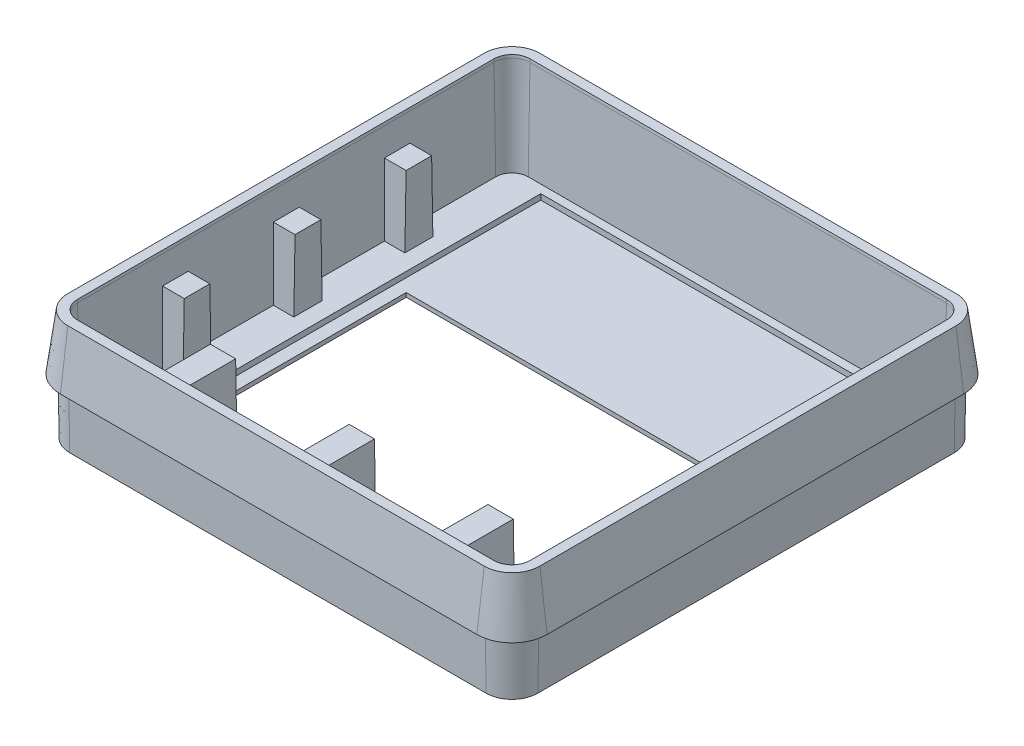
from build123d import *

# Parameters (mm, degrees)
BOSS_EXTRUDE1_DEPTH  = 4
BOSS_EXTRUDE1_DRAFT  = -1
SHELL1_T             = -0.35
SKETCH2_W            = 12.58
SKETCH2_H            = 6.98
CUT_EXTRUDE1_DEPTH   = 2
SKETCH3_W            = 13.5
SKETCH3_H            = 13.096235698
CUT_EXTRUDE2_DEPTH   = 0.2
BOSS_EXTRUDE3_REACH  = 20.425
BOSS_EXTRUDE4_REACH  = 20.425
LPATTERN2_COUNT      = 2
LPATTERN2_PITCH      = 4
MIRROR4_COPY_1_REACH = 20.425
LPATTERN3_COUNT      = 2
LPATTERN3_PITCH      = 4
MIRROR5_COPY_1_REACH = 20.425
BOSS_EXTRUDE5_REACH  = 18.785
LPATTERN4_COUNT      = 2
LPATTERN4_PITCH      = 5
MIRROR6_COPY_1_REACH = 18.785
MIRROR6_COPY_2_REACH = 18.785


with BuildPart() as part:
    # Sketch1 → Boss-Extrude1 (with draft: the straight prism first)
    with BuildSketch(Plane(origin=(0, 0, 0), x_dir=(1, 0, 0), z_dir=(0, 1, 0))):
        with BuildLine():
            Line((-7.5, -8.5), (7.5, -8.5))
            ThreePointArc((7.5, -8.5), (8.207106781, -8.207106781), (8.5, -7.5))
            Line((8.5, -7.5), (8.5, 7.5))
            ThreePointArc((8.5, 7.5), (8.207106781, 8.207106781), (7.5, 8.5))
            Line((7.5, 8.5), (-7.5, 8.5))
            ThreePointArc((-7.5, 8.5), (-8.207106781, 8.207106781), (-8.5, 7.5))
            Line((-8.5, 7.5), (-8.5, -7.5))
            ThreePointArc((-8.5, -7.5), (-8.207106781, -8.207106781), (-7.5, -8.5))
        make_face()
    extrude(amount=-BOSS_EXTRUDE1_DEPTH)
    # Boss-Extrude1: the draft: its side faces are tilted about the plane it starts from
    boss_extrude1_sides = [part.faces().sort_by_distance(p)[0] for p in [
        (0, -2, 8.5),
        (8.207106781, -2, 8.207106781),
        (8.5, -2, 0),
        (8.207106781, -2, -8.207106781),
        (0, -2, -8.5),
        (-8.207106781, -2, -8.207106781),
        (-8.5, -2, 0),
        (-8.207106781, -2, 8.207106781),
    ]]
    draft(boss_extrude1_sides, Plane(origin=(0, 0, 0), x_dir=(1, 0, 0), z_dir=(0, 1, 0)), BOSS_EXTRUDE1_DRAFT)

    # Shell1
    shell1_openings = [part.faces().sort_by_distance(p)[0] for p in [
        (0, 0, 0),
    ]]
    offset(amount=SHELL1_T, openings=shell1_openings, kind=Kind.INTERSECTION)

    # Sketch2 → Cut-Extrude1 (cut)
    with BuildSketch(Plane.XZ.offset(4)):
        with Locations((0, 1.01)):
            Rectangle(SKETCH2_W, SKETCH2_H)
    extrude(amount=-CUT_EXTRUDE1_DEPTH, mode=Mode.SUBTRACT)

    # Sketch3 → Cut-Extrude2 (cut)
    with BuildSketch(Plane(origin=(0, -3.65, 0), x_dir=(1, 0, 0), z_dir=(0, 1, 0))):
        with Locations((0, 1.238117849)):
            Rectangle(SKETCH3_W, SKETCH3_H)
    extrude(amount=-CUT_EXTRUDE2_DEPTH, mode=Mode.SUBTRACT)

    # Boss-Extrude3: up to this plane
    boss_extrude3_end = Plane(origin=(8.150053307, 0.006108342, 7.5), z_dir=(0.9998476951563913, -0.01745240643728355, 0))
    # Sketch11 → Boss-Extrude3 (add, up to the surface)
    with BuildSketch(Plane.ZY.offset(-7.35), mode=Mode.PRIVATE) as boss_extrude3_sk1:
        Polygon((-0.455489584, -1.1), (0.46508987, -1.1), (0.509600286, -3.65), (-0.5, -3.65), align=None)
    boss_extrude3_tool1 = split(extrude(boss_extrude3_sk1.sketch, amount=-BOSS_EXTRUDE3_REACH, mode=Mode.PRIVATE), bisect_by=boss_extrude3_end, keep=Keep.BOTH, mode=Mode.PRIVATE)
    boss_extrude3 = boss_extrude3_tool1.solids().sort_by_distance((7.35, -2.394601, 0.0048))[0]
    add(boss_extrude3)

    # Boss-Extrude4: up to this plane
    boss_extrude4_end = Plane(origin=(-8.150053307, 0.006108342, 7.5), z_dir=(-0.9998476951563913, -0.01745240643728355, 0))
    # Sketch13 → Boss-Extrude4 (add, up to the surface)
    with BuildSketch(Plane(origin=(-7.35, 0, 0), x_dir=(0, 0, -1), z_dir=(1, 0, 0)), mode=Mode.PRIVATE) as boss_extrude4_sk1:
        Polygon((-0.5, -3.65), (0.509600286, -3.65), (0.46508987, -1.1), (-0.455489584, -1.1), align=None)
    boss_extrude4_tool1 = split(extrude(boss_extrude4_sk1.sketch, amount=-BOSS_EXTRUDE4_REACH, mode=Mode.PRIVATE), bisect_by=boss_extrude4_end, keep=Keep.BOTH, mode=Mode.PRIVATE)
    boss_extrude4 = boss_extrude4_tool1.solids().sort_by_distance((-7.35, -2.394601, -0.0048))[0]
    add(boss_extrude4)

    # LPattern2: Boss-Extrude3 ×2
    with Locations(*[(0, 0, i * LPATTERN2_PITCH) for i in range(1, LPATTERN2_COUNT)]):
        add(boss_extrude3)

    # Mirror4: Boss-Extrude3 across plane
    add(boss_extrude3.mirror(Plane.XY))

    # Mirror4 copy 1: up to this plane
    mirror4_copy_1_end = Plane(origin=(8.150053307, 0.006108342, 7.5), z_dir=(0.9998476951563913, -0.01745240643728355, 0))
    # Mirror4 copy 1 sketch → Mirror4 copy 1 (add, up to the surface)
    with BuildSketch(Plane(origin=(7.35, 0, -4), x_dir=(0, 0, -1), z_dir=(-1, 0, 0)), mode=Mode.PRIVATE) as mirror4_copy_1_sk1:
        Polygon((-0.455489584, 1.1), (0.46508987, 1.1), (0.509600286, 3.65), (-0.5, 3.65), align=None)
    mirror4_copy_1_tool1 = split(extrude(mirror4_copy_1_sk1.sketch, amount=-MIRROR4_COPY_1_REACH, mode=Mode.PRIVATE), bisect_by=mirror4_copy_1_end, keep=Keep.BOTH, mode=Mode.PRIVATE)
    add(mirror4_copy_1_tool1.solids().sort_by_distance((7.35, -2.394601, 0.0048))[0])

    # LPattern3: Boss-Extrude4 ×2
    with Locations(*[(0, 0, i * LPATTERN3_PITCH) for i in range(1, LPATTERN3_COUNT)]):
        add(boss_extrude4)

    # Mirror5: Boss-Extrude4 across plane
    add(boss_extrude4.mirror(Plane.XY))

    # Mirror5 copy 1: up to this plane
    mirror5_copy_1_end = Plane(origin=(-8.150053307, 0.006108342, 7.5), z_dir=(-0.9998476951563913, -0.01745240643728355, 0))
    # Mirror5 copy 1 sketch → Mirror5 copy 1 (add, up to the surface)
    with BuildSketch(Plane(origin=(-7.35, 0, -4), x_dir=(0, 0, 1), z_dir=(1, 0, 0)), mode=Mode.PRIVATE) as mirror5_copy_1_sk1:
        Polygon((-0.5, 3.65), (0.509600286, 3.65), (0.46508987, 1.1), (-0.455489584, 1.1), align=None)
    mirror5_copy_1_tool1 = split(extrude(mirror5_copy_1_sk1.sketch, amount=-MIRROR5_COPY_1_REACH, mode=Mode.PRIVATE), bisect_by=mirror5_copy_1_end, keep=Keep.BOTH, mode=Mode.PRIVATE)
    add(mirror5_copy_1_tool1.solids().sort_by_distance((-7.35, -2.394601, -0.0048))[0])

    # Boss-Extrude5: up to this plane
    boss_extrude5_end = Plane(origin=(-7.5, 0.006108342, 8.150053307), z_dir=(0, -0.017452406437283553, 0.9998476951563913))
    # Sketch16 → Boss-Extrude5 (add, up to the surface)
    with BuildSketch(Plane.XY.offset(5.41), mode=Mode.PRIVATE) as boss_extrude5_sk1:
        Polygon((-0.5, -3.65), (0.5, -3.65), (0.455489584, -1.1), (-0.455489584, -1.1), align=None)
    boss_extrude5_tool1 = split(extrude(boss_extrude5_sk1.sketch, amount=BOSS_EXTRUDE5_REACH, mode=Mode.PRIVATE), bisect_by=boss_extrude5_end, keep=Keep.BOTH, mode=Mode.PRIVATE)
    boss_extrude5 = boss_extrude5_tool1.solids().sort_by_distance((0, -2.394798, 5.41))[0]
    add(boss_extrude5)

    # LPattern4: Boss-Extrude5 ×2
    with Locations(*[(i * LPATTERN4_PITCH, 0, 0) for i in range(1, LPATTERN4_COUNT)]):
        add(boss_extrude5)

    # Mirror6 copy 1: up to this plane
    mirror6_copy_1_end = Plane(origin=(-7.5, 0.006108342, 8.150053307), z_dir=(0, -0.017452406437283553, 0.9998476951563913))
    # Mirror6 copy 1 sketch → Mirror6 copy 1 (add, up to the surface)
    with BuildSketch(Plane(origin=(-5, 0, 5.41), x_dir=(-1, 0, 0), z_dir=(0, 0, 1)), mode=Mode.PRIVATE) as mirror6_copy_1_sk1:
        Polygon((-0.5, 3.65), (0.5, 3.65), (0.455489584, 1.1), (-0.455489584, 1.1), align=None)
    mirror6_copy_1_tool1 = split(extrude(mirror6_copy_1_sk1.sketch, amount=MIRROR6_COPY_1_REACH, mode=Mode.PRIVATE), bisect_by=mirror6_copy_1_end, keep=Keep.BOTH, mode=Mode.PRIVATE)
    add(mirror6_copy_1_tool1.solids().sort_by_distance((0, -2.394798, 5.41))[0])

    # Mirror6 copy 2: up to this plane
    mirror6_copy_2_end = Plane(origin=(-7.5, 0.006108342, 8.150053307), z_dir=(0, -0.017452406437283553, 0.9998476951563913))
    # Mirror6 copy 2 sketch → Mirror6 copy 2 (add, up to the surface)
    with BuildSketch(Plane(origin=(0, 0, 5.41), x_dir=(-1, 0, 0), z_dir=(0, 0, 1)), mode=Mode.PRIVATE) as mirror6_copy_2_sk1:
        Polygon((-0.5, 3.65), (0.5, 3.65), (0.455489584, 1.1), (-0.455489584, 1.1), align=None)
    mirror6_copy_2_tool1 = split(extrude(mirror6_copy_2_sk1.sketch, amount=MIRROR6_COPY_2_REACH, mode=Mode.PRIVATE), bisect_by=mirror6_copy_2_end, keep=Keep.BOTH, mode=Mode.PRIVATE)
    add(mirror6_copy_2_tool1.solids().sort_by_distance((0, -2.394798, 5.41))[0])

    # Sweep1: sweep along a path in Sketch18
    with BuildLine(Plane(origin=(0, -2, 0), x_dir=(-1, 0, 0), z_dir=(0, -1, 0))) as sweep1_path:
        Line((8.5, 7.5), (8.5, -7.5))
        ThreePointArc((8.5, -7.5), (8.207106781, -8.207106781), (7.5, -8.5))
        Line((7.5, -8.5), (-7.5, -8.5))
        ThreePointArc((-7.5, -8.5), (-8.207106781, -8.207106781), (-8.5, -7.5))
        Line((-8.5, -7.5), (-8.5, 7.5))
        ThreePointArc((-8.5, 7.5), (-8.207106781, 8.207106781), (-7.5, 8.5))
        Line((-7.5, 8.5), (7.5, 8.5))
        ThreePointArc((7.5, 8.5), (8.207106781, 8.207106781), (8.5, 7.5))
    # Sketch17 → Sweep1 (sweep)
    with BuildSketch(Plane.XY):
        Polygon((-8.5, 0), (-8.46508987, -2), (-8.76508987, -2), align=None)
    sweep(path=sweep1_path.line)

    # Sweep2: sweep along a path in Sketch23
    with BuildLine(Plane(origin=(0, 0, 0), x_dir=(1, 0, 0), z_dir=(0, 1, 0))) as sweep2_path:
        Line((8.149946685, -7.5), (8.149946685, 7.5))
        ThreePointArc((8.149946685, 7.5), (7.959581709, 7.959581709), (7.5, 8.149946685))
        Line((7.5, 8.149946685), (-7.5, 8.149946685))
        ThreePointArc((-7.5, 8.149946685), (-7.959581709, 7.959581709), (-8.149946685, 7.5))
        Line((-8.149946685, 7.5), (-8.149946685, -7.5))
        ThreePointArc((-8.149946685, -7.5), (-7.959581709, -7.959581709), (-7.5, -8.149946685))
        Line((-7.5, -8.149946685), (7.5, -8.149946685))
        ThreePointArc((7.5, -8.149946685), (7.959581709, -7.959581709), (8.149946685, -7.5))
    # Sketch19 → Sweep2 (sweep)
    with BuildSketch(Plane.XY):
        Polygon((8.149946685, 0), (8.148156734, -0.102546259), (8.14097505, -0.102546259), align=None)
    sweep(path=sweep2_path.line)


solid = part.part
